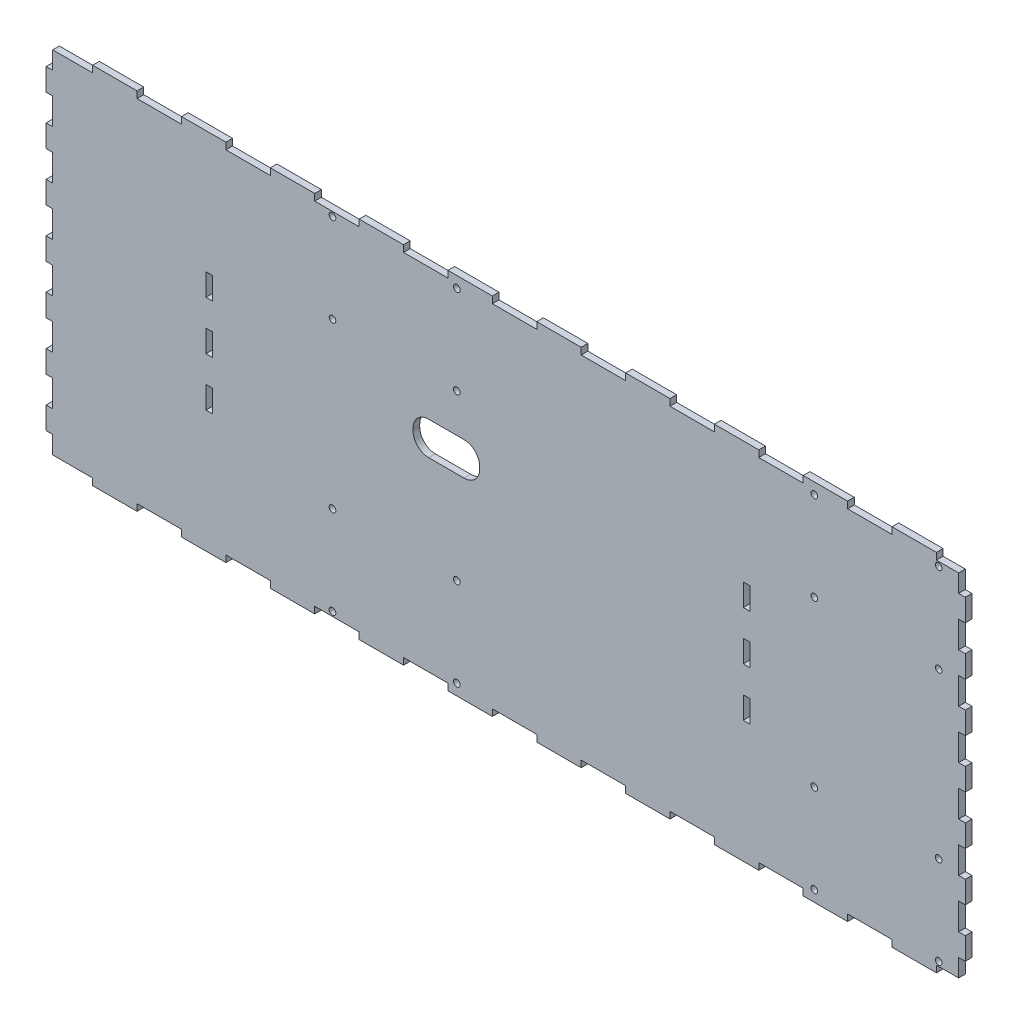
from build123d import *

# Parameters (mm, degrees)
SKETCH1_W           = 414
SKETCH1_H           = 164
BOSS_EXTRUDE1_DEPTH = 3
SKETCH2_W           = 3
SKETCH2_H           = 11
SKETCH2_H_2         = 12
CUT_EXTRUDE1_DEPTH  = 3
CUT_EXTRUDE2_DEPTH  = 3
SKETCH4_R           = 1.5
SKETCH4_W           = 3
SKETCH4_H           = 10
CUT_EXTRUDE3_DEPTH  = 10
CUT_EXTRUDE4_DEPTH  = 10


with BuildPart() as part:
    # Sketch1 → Boss-Extrude1 (new body)
    with BuildSketch(Plane.XY.offset(152)):
        Rectangle(SKETCH1_W, SKETCH1_H)
    extrude(amount=BOSS_EXTRUDE1_DEPTH)

    # Sketch2 → Cut-Extrude1 (cut)
    with BuildSketch(Plane.ZY.offset(207)):
        with Locations((153.5, -76.5)):
            Rectangle(SKETCH2_W, SKETCH2_H)
        with Locations((153.5, -55)):
            Rectangle(SKETCH2_W, SKETCH2_H_2)
        with Locations((153.5, -33)):
            Rectangle(SKETCH2_W, SKETCH2_H_2)
        with Locations((153.5, -11)):
            Rectangle(SKETCH2_W, SKETCH2_H_2)
        with Locations((153.5, 11)):
            Rectangle(SKETCH2_W, SKETCH2_H_2)
        with Locations((153.5, 33)):
            Rectangle(SKETCH2_W, SKETCH2_H_2)
        with Locations((153.5, 55)):
            Rectangle(SKETCH2_W, SKETCH2_H_2)
        with Locations((153.5, 76.5)):
            Rectangle(SKETCH2_W, SKETCH2_H)
    cut_extrude1 = extrude(amount=-CUT_EXTRUDE1_DEPTH, mode=Mode.SUBTRACT)

    # Mirror1: Cut-Extrude1 across plane
    add(cut_extrude1.mirror(Plane(origin=(0, 0, 0), x_dir=(0, 0, 1), z_dir=(1, 0, 0))), mode=Mode.SUBTRACT)

    # Sketch3 → Cut-Extrude2 (cut)
    with BuildSketch(Plane(origin=(0, 82, 0), x_dir=(1, 0, 0), z_dir=(0, 1, 0))):
        Polygon((174, -152), (194, -152), (194, -155), (204, -155), (204, -145), (207, -145), (207, -133), (204, -133), (204, -123), (207, -123), (207, -111), (204, -111), (204, -101), (207, -101), (207, -89), (204, -89), (204, -79), (207, -79), (207, -67), (204, -67), (204, -57), (207, -57), (207, -45), (204, -45), (204, -35), (207, -35), (207, -23), (204, -23), (204, -16), (-204, -16), (-204, -23), (-207, -23), (-207, -35), (-204, -35), (-204, -45), (-207, -45), (-207, -57), (-204, -57), (-204, -67), (-207, -67), (-207, -79), (-204, -79), (-204, -89), (-207, -89), (-207, -101), (-204, -101), (-204, -111), (-207, -111), (-207, -123), (-204, -123), (-204, -133), (-207, -133), (-207, -145), (-204, -145), (-204, -155), (-186, -155), (-186, -152), (-166, -152), (-166, -155), (-146, -155), (-146, -152), (-126, -152), (-126, -155), (-106, -155), (-106, -152), (-86, -152), (-86, -155), (-66, -155), (-66, -152), (-46, -152), (-46, -155), (-26, -155), (-26, -152), (-6, -152), (-6, -155), (14, -155), (14, -152), (34, -152), (34, -155), (54, -155), (54, -152), (74, -152), (74, -155), (94, -155), (94, -152), (114, -152), (114, -155), (134, -155), (134, -152), (154, -152), (154, -155), (174, -155), align=None)
    cut_extrude2 = extrude(amount=-CUT_EXTRUDE2_DEPTH, mode=Mode.SUBTRACT)

    # Mirror2: Cut-Extrude2 across plane
    add(cut_extrude2.mirror(Plane.ZX), mode=Mode.SUBTRACT)

    # Sketch4 → Cut-Extrude3 (cut)
    with BuildSketch(Plane.XY.offset(155)):
        with Locations((139, 37)):
            Circle(SKETCH4_R)
        with Locations((195, 37)):
            Circle(SKETCH4_R)
        with Locations((195, 77)):
            Circle(SKETCH4_R)
        with Locations((139, 77)):
            Circle(SKETCH4_R)
        with Locations((-78, 77)):
            Circle(SKETCH4_R)
        with Locations((-22, 77)):
            Circle(SKETCH4_R)
        with Locations((-78, 37)):
            Circle(SKETCH4_R)
        with Locations((-22, 37)):
            Circle(SKETCH4_R)
        with Locations((139, -77)):
            Circle(SKETCH4_R)
        with Locations((195, -77)):
            Circle(SKETCH4_R)
        with Locations((195, -37)):
            Circle(SKETCH4_R)
        with Locations((139, -37)):
            Circle(SKETCH4_R)
        with Locations((-22, -37)):
            Circle(SKETCH4_R)
        with Locations((-78, -37)):
            Circle(SKETCH4_R)
        with Locations((-22, -77)):
            Circle(SKETCH4_R)
        with Locations((-78, -77)):
            Circle(SKETCH4_R)
        with Locations((-133.5, 22)):
            Rectangle(SKETCH4_W, SKETCH4_H)
        with Locations((-133.5, 0)):
            Rectangle(SKETCH4_W, SKETCH4_H)
        with Locations((-133.5, -22)):
            Rectangle(SKETCH4_W, SKETCH4_H)
        with Locations((108.5, 22)):
            Rectangle(SKETCH4_W, SKETCH4_H)
        with Locations((108.5, 0)):
            Rectangle(SKETCH4_W, SKETCH4_H)
        with Locations((108.5, -22)):
            Rectangle(SKETCH4_W, SKETCH4_H)
    extrude(amount=-CUT_EXTRUDE3_DEPTH, mode=Mode.SUBTRACT)

    # Sketch5 → Cut-Extrude4 (cut)
    with BuildSketch(Plane.XY.offset(155)):
        with BuildLine():
            Line((-34.7, 4.6), (-18.7, 4.6))
            ThreePointArc((-18.7, 4.6), (-13.750252532, 6.650252532), (-11.7, 11.6))
            Line((-11.7, 11.6), (-11.7, 12.6))
            ThreePointArc((-11.7, 12.6), (-13.750252532, 17.549747468), (-18.7, 19.6))
            Line((-18.7, 19.6), (-34.7, 19.6))
            ThreePointArc((-34.7, 19.6), (-39.649747468, 17.549747468), (-41.7, 12.6))
            Line((-41.7, 12.6), (-41.7, 11.6))
            ThreePointArc((-41.7, 11.6), (-39.649747468, 6.650252532), (-34.7, 4.6))
        make_face()
    extrude(amount=-CUT_EXTRUDE4_DEPTH, mode=Mode.SUBTRACT)


solid = part.part
